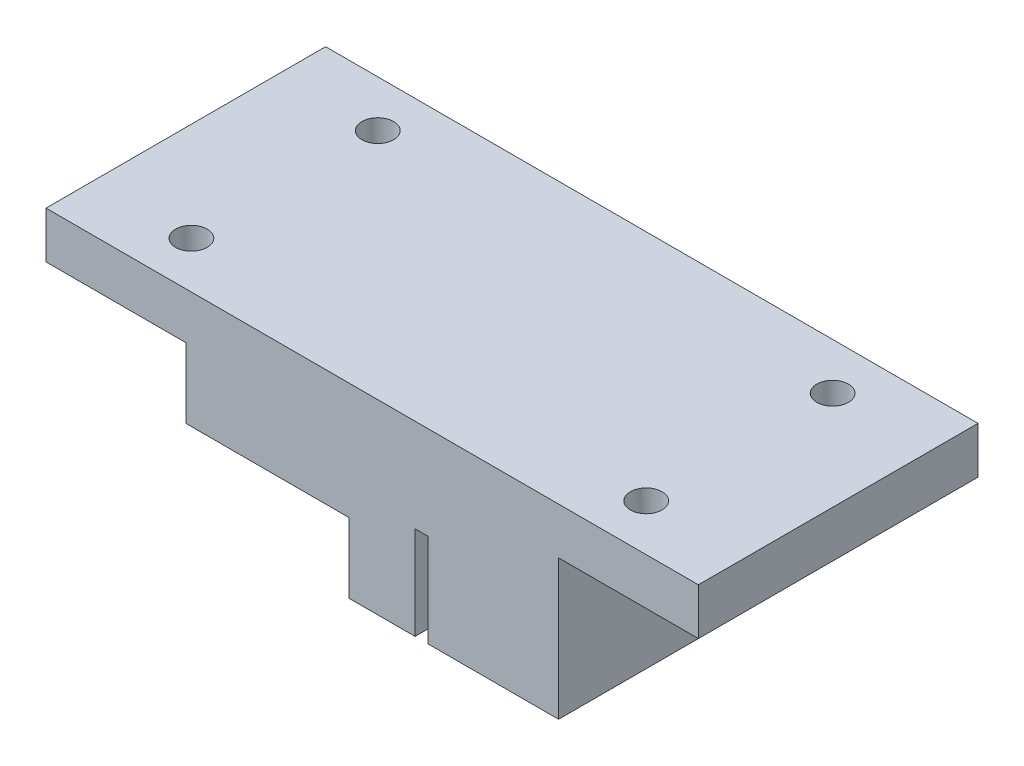
from build123d import *

# Parameters (mm, degrees)
SKETCH1_W           = 88.9
SKETCH1_H           = 38.1
BOSS_EXTRUDE1_DEPTH = 6.35
CUT_EXTRUDE1_REACH  = 50.775
SKETCH2_R           = 2.159
SKETCH3_W           = 50.8
SKETCH3_H           = 38.1
BOSS_EXTRUDE2_DEPTH = 19.05
SKETCH4_W           = 22.225
SKETCH4_H           = 38.1
CUT_EXTRUDE2_DEPTH  = 9.525
CUT_EXTRUDE3_DEPTH  = 12.7


with BuildPart() as part:
    # Sketch1 → Boss-Extrude1 (new body)
    with BuildSketch(Plane(origin=(0, 0, 0), x_dir=(1, 0, 0), z_dir=(0, 1, 0))):
        Rectangle(SKETCH1_W, SKETCH1_H)
    extrude(amount=BOSS_EXTRUDE1_DEPTH)

    # Sketch2 → Cut-Extrude1 (cut, up to next)
    with BuildSketch(Plane(origin=(0, 6.35, 0), x_dir=(1, 0, 0), z_dir=(0, 1, 0)), mode=Mode.PRIVATE) as cut_extrude1_sk1:
        with Locations(Location((-30.988, 12.7, 0), (0, 0, 270))):
            Circle(SKETCH2_R)
    cut_extrude1_tool1 = extrude(cut_extrude1_sk1.sketch, amount=-CUT_EXTRUDE1_REACH, mode=Mode.PRIVATE) & part.part
    # Sketch2 → Cut-Extrude1 (cut, up to next)
    with BuildSketch(Plane(origin=(0, 6.35, 0), x_dir=(1, 0, 0), z_dir=(0, 1, 0)), mode=Mode.PRIVATE) as cut_extrude1_sk2:
        with Locations(Location((30.988, 12.7, 0), (0, 0, 270))):
            Circle(SKETCH2_R)
    cut_extrude1_tool2 = extrude(cut_extrude1_sk2.sketch, amount=-CUT_EXTRUDE1_REACH, mode=Mode.PRIVATE) & part.part
    # Sketch2 → Cut-Extrude1 (cut, up to next)
    with BuildSketch(Plane(origin=(0, 6.35, 0), x_dir=(1, 0, 0), z_dir=(0, 1, 0)), mode=Mode.PRIVATE) as cut_extrude1_sk3:
        with Locations(Location((30.988, -12.7, 0), (0, 0, 270))):
            Circle(SKETCH2_R)
    cut_extrude1_tool3 = extrude(cut_extrude1_sk3.sketch, amount=-CUT_EXTRUDE1_REACH, mode=Mode.PRIVATE) & part.part
    # Sketch2 → Cut-Extrude1 (cut, up to next)
    with BuildSketch(Plane(origin=(0, 6.35, 0), x_dir=(1, 0, 0), z_dir=(0, 1, 0)), mode=Mode.PRIVATE) as cut_extrude1_sk4:
        with Locations(Location((-30.988, -12.7, 0), (0, 0, 270))):
            Circle(SKETCH2_R)
    cut_extrude1_tool4 = extrude(cut_extrude1_sk4.sketch, amount=-CUT_EXTRUDE1_REACH, mode=Mode.PRIVATE) & part.part
    add(cut_extrude1_tool1.solids().sort_by_distance((-30.988, 6.35, -12.7))[0], mode=Mode.SUBTRACT)
    add(cut_extrude1_tool2.solids().sort_by_distance((30.988, 6.35, -12.7))[0], mode=Mode.SUBTRACT)
    add(cut_extrude1_tool3.solids().sort_by_distance((30.988, 6.35, 12.7))[0], mode=Mode.SUBTRACT)
    add(cut_extrude1_tool4.solids().sort_by_distance((-30.988, 6.35, 12.7))[0], mode=Mode.SUBTRACT)

    # Sketch3 → Boss-Extrude2 (add)
    with BuildSketch(Plane.XZ):
        Rectangle(SKETCH3_W, SKETCH3_H)
    extrude(amount=BOSS_EXTRUDE2_DEPTH)

    # Sketch4 → Cut-Extrude2 (cut)
    with BuildSketch(Plane(origin=(0, -19.05, 0), x_dir=(-1, 0, 0), z_dir=(0, -1, 0))):
        with Locations((14.2875, 0)):
            Rectangle(SKETCH4_W, SKETCH4_H)
    extrude(amount=-CUT_EXTRUDE2_DEPTH, mode=Mode.SUBTRACT)

    # Sketch5 → Cut-Extrude3 (cut)
    with BuildSketch(Plane.XZ.offset(19.05)):
        Polygon((5.842, -19.05), (5.842, -6.35), (19.812, -6.35), (19.812, 6.35), (5.842, 6.35), (5.842, 19.05), (7.62, 19.05), (7.62, 8.128), (21.59, 8.128), (21.59, -8.128), (7.62, -8.128), (7.62, -19.05), align=None)
    extrude(amount=-CUT_EXTRUDE3_DEPTH, mode=Mode.SUBTRACT)


solid = part.part
